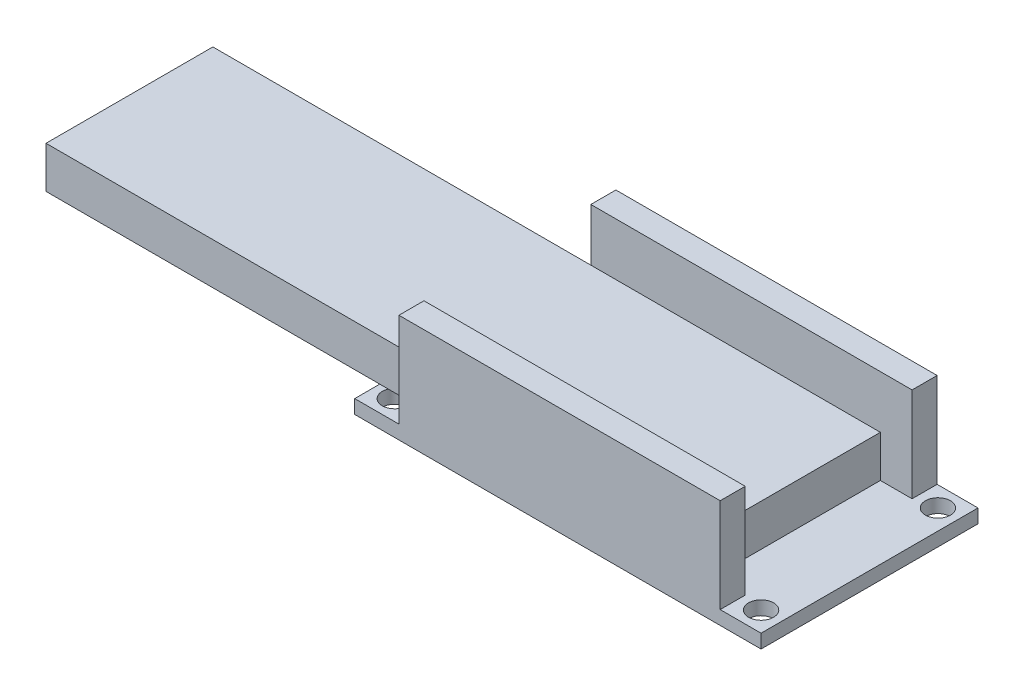
from build123d import *

# Parameters (mm, degrees)
SKETCH1_W           = 48.7
SKETCH1_H           = 26
SKETCH1_R           = 1.5
BOSS_EXTRUDE1_DEPTH = 1.65
SKETCH2_W           = 38.5
SKETCH2_H           = 3
BOSS_EXTRUDE2_DEPTH = 11.3
SKETCH3_W           = 80
SKETCH3_H           = 20
BOSS_EXTRUDE3_DEPTH = 5


with BuildPart() as part:
    # Sketch1 → Boss-Extrude1 (new body)
    with BuildSketch(Plane(origin=(0, 0, 0), x_dir=(1, 0, 0), z_dir=(0, 1, 0))):
        Rectangle(SKETCH1_W, SKETCH1_H)
        with Locations(Location((-21.95, 10.6, 0), (0, 0, 270))):
            Circle(SKETCH1_R, mode=Mode.SUBTRACT)
        with Locations(Location((-21.95, -10.6, 0), (0, 0, 90))):
            Circle(SKETCH1_R, mode=Mode.SUBTRACT)
        with Locations(Location((21.95, -10.6, 0), (0, 0, 270))):
            Circle(SKETCH1_R, mode=Mode.SUBTRACT)
        with Locations(Location((21.95, 10.6, 0), (0, 0, 90))):
            Circle(SKETCH1_R, mode=Mode.SUBTRACT)
    extrude(amount=BOSS_EXTRUDE1_DEPTH)

    # Sketch2 → Boss-Extrude2 (add)
    with BuildSketch(Plane(origin=(0, 1.65, 0), x_dir=(1, 0, 0), z_dir=(0, 1, 0))):
        with Locations((0.2, 11.5)):
            Rectangle(SKETCH2_W, SKETCH2_H)
        with Locations((0.2, -11.5)):
            Rectangle(SKETCH2_W, SKETCH2_H)
    extrude(amount=BOSS_EXTRUDE2_DEPTH)

    # Sketch3 → Boss-Extrude3 (add)
    with BuildSketch(Plane(origin=(0, 1.65, 0), x_dir=(1, 0, 0), z_dir=(0, 1, 0))):
        with Locations((-24.35, 0)):
            Rectangle(SKETCH3_W, SKETCH3_H)
    extrude(amount=BOSS_EXTRUDE3_DEPTH)


solid = part.part
